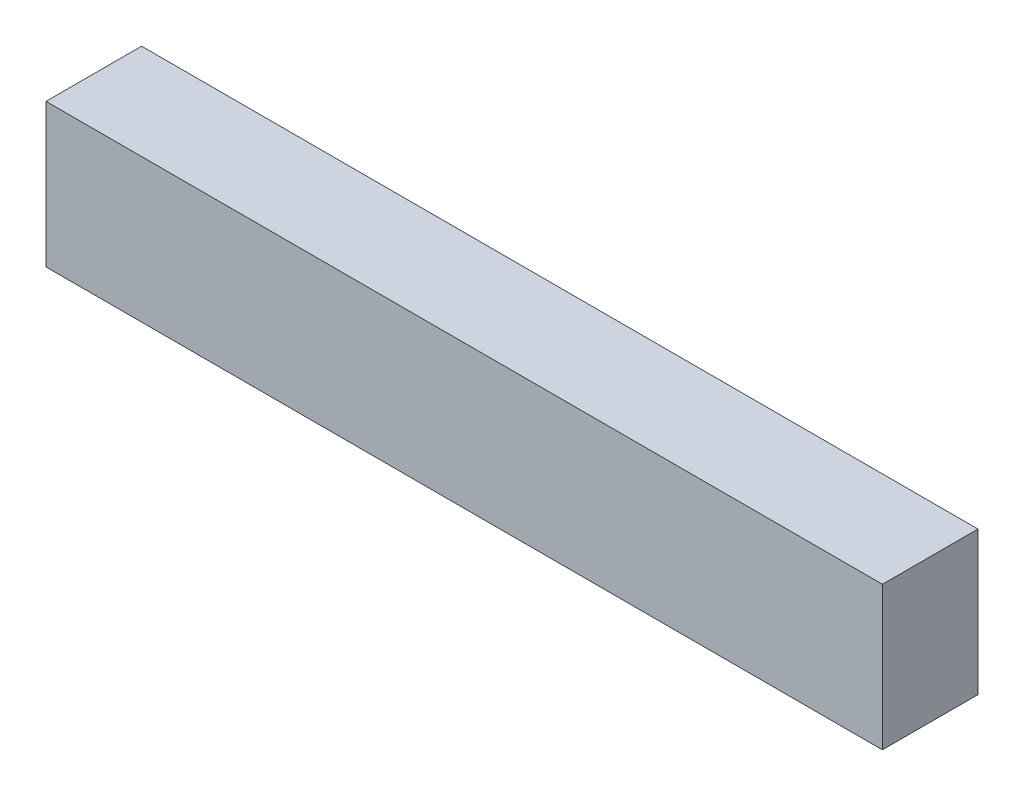
from build123d import *

# Parameters (mm, degrees)
SKETCH_8_W      = 350
SKETCH_8_H      = 60
EXTRUDE_1_DEPTH = 40


with BuildPart() as part:
    # 草图8 → 凸台-拉伸1 (new body)
    with BuildSketch(Plane.XY):
        Rectangle(SKETCH_8_W, SKETCH_8_H)
    extrude(amount=EXTRUDE_1_DEPTH)


solid = part.part
